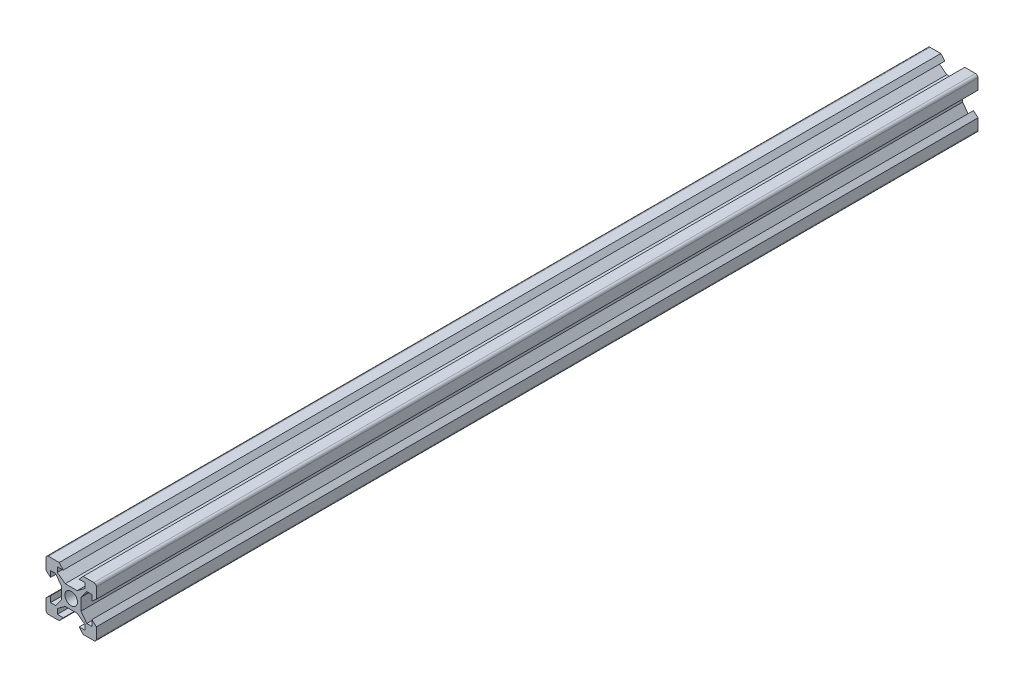
from build123d import *

# Parameters (mm, degrees)
SKETCH1_R           = 2.5
BOSS_EXTRUDE1_DEPTH = 350


with BuildPart() as part:
    # Sketch1 → Boss-Extrude1 (new body)
    with BuildSketch(Plane.XY):
        with BuildLine():
            Line((-5.5, 8.2), (-3.15, 8.2))
            Line((-3.15, 8.2), (-4.75, 10))
            Line((-4.75, 10), (-9, 10))
            ThreePointArc((-9, 10), (-9.707106781, 9.707106781), (-10, 9))
            Line((-10, 9), (-10, 4.75))
            Line((-10, 4.75), (-8.2, 3.15))
            Line((-8.2, 3.15), (-8.2, 5.5))
            Line((-8.2, 5.5), (-6.2, 5.5))
            Line((-6.2, 5.5), (-3.9, 2.387933369))
            Line((-3.9, 2.387933369), (-3.9, -2.387933369))
            Line((-3.9, -2.387933369), (-6.2, -5.5))
            Line((-6.2, -5.5), (-8.2, -5.5))
            Line((-8.2, -5.5), (-8.2, -3.15))
            Line((-8.2, -3.15), (-10, -4.75))
            Line((-10, -4.75), (-10, -9))
            ThreePointArc((-10, -9), (-9.707106781, -9.707106781), (-9, -10))
            Line((-9, -10), (-4.75, -10))
            Line((-4.75, -10), (-3.15, -8.2))
            Line((-3.15, -8.2), (-5.5, -8.2))
            Line((-5.5, -8.2), (-5.5, -6.2))
            Line((-5.5, -6.2), (-2.387933369, -3.9))
            Line((-2.387933369, -3.9), (2.387933369, -3.9))
            Line((2.387933369, -3.9), (5.5, -6.2))
            Line((5.5, -6.2), (5.5, -8.2))
            Line((5.5, -8.2), (3.15, -8.2))
            Line((3.15, -8.2), (4.75, -10))
            Line((4.75, -10), (9, -10))
            ThreePointArc((9, -10), (9.707106781, -9.707106781), (10, -9))
            Line((10, -9), (10, -4.75))
            Line((10, -4.75), (8.2, -3.15))
            Line((8.2, -3.15), (8.2, -5.5))
            Line((8.2, -5.5), (6.2, -5.5))
            Line((6.2, -5.5), (3.9, -2.387933369))
            Line((3.9, -2.387933369), (3.9, 2.387933369))
            Line((3.9, 2.387933369), (6.2, 5.5))
            Line((6.2, 5.5), (8.2, 5.5))
            Line((8.2, 5.5), (8.2, 3.15))
            Line((8.2, 3.15), (10, 4.75))
            Line((10, 4.75), (10, 9))
            ThreePointArc((10, 9), (9.707106781, 9.707106781), (9, 10))
            Line((9, 10), (4.75, 10))
            Line((4.75, 10), (3.15, 8.2))
            Line((3.15, 8.2), (5.5, 8.2))
            Line((5.5, 8.2), (5.5, 6.2))
            Line((5.5, 6.2), (2.387933369, 3.9))
            Line((2.387933369, 3.9), (-2.387933369, 3.9))
            Line((-2.387933369, 3.9), (-5.5, 6.2))
            Line((-5.5, 6.2), (-5.5, 8.2))
        make_face()
        Circle(SKETCH1_R, mode=Mode.SUBTRACT)
    extrude(amount=BOSS_EXTRUDE1_DEPTH)


solid = part.part
